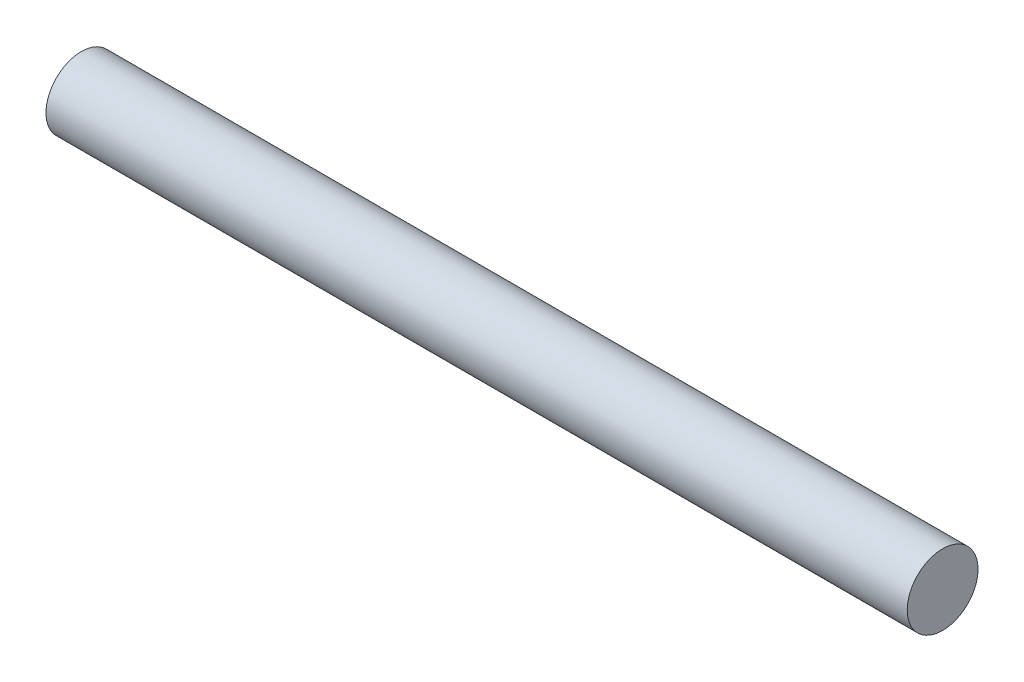
from build123d import *

# Parameters (mm, degrees)
SKETCH1_R           = 3.57
BOSS_EXTRUDE1_DEPTH = 86.856577766


with BuildPart() as part:
    # Sketch1 → Boss-Extrude1 (new body)
    with BuildSketch(Plane(origin=(0, 0, 0), x_dir=(0, 0, -1), z_dir=(1, 0, 0))):
        with Locations(Location((0, 0, 0), (0, 0, 270))):
            Circle(SKETCH1_R)
    extrude(amount=BOSS_EXTRUDE1_DEPTH)


solid = part.part
